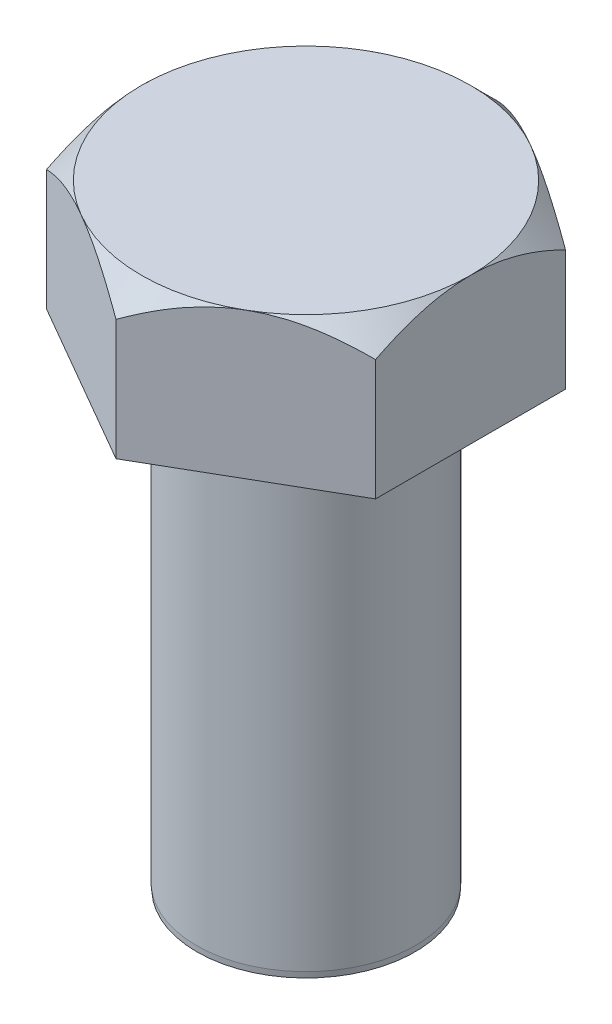
from build123d import *

# Parameters (mm, degrees)
BOSS_EXTRUDE1_DEPTH = 6.35
SKETCH2_R           = 4.7625
BOSS_EXTRUDE2_DEPTH = 20.32
SKETCH3_OUTSIDE_W   = 63.834
SKETCH3_OUTSIDE_H   = 66.046
SKETCH3_OUTSIDE_R   = 7.1501
CUT_EXTRUDE1_DEPTH  = 20.32
CUT_EXTRUDE1_DRAFT  = -45
CHAMFER1_SIZE       = 0.254
CHAMFER1_SIZE2      = 0.022222121


with BuildPart() as part:
    # Sketch1 → Boss-Extrude1 (new body)
    with BuildSketch(Plane(origin=(0, 0, 0), x_dir=(1, 0, 0), z_dir=(0, 1, 0))):
        Polygon((0, 8.256224319), (-7.1501, 4.12811216), (-7.1501, -4.12811216), (0, -8.256224319), (7.1501, -4.12811216), (7.1501, 4.12811216), align=None)
    extrude(amount=BOSS_EXTRUDE1_DEPTH)

    # Sketch2 → Boss-Extrude2 (add)
    with BuildSketch(Plane.XZ):
        with Locations(Location((0, 0, 0), (0, 0, 90))):
            Circle(SKETCH2_R)
    extrude(amount=BOSS_EXTRUDE2_DEPTH)


with BuildPart() as cut_extrude1_tool:
    # Sketch3 outside → Cut-Extrude1 (with draft: the straight prism first)
    with BuildSketch(Plane(origin=(0, 6.35, 0), x_dir=(1, 0, 0), z_dir=(0, 1, 0))):
        Rectangle(SKETCH3_OUTSIDE_W, SKETCH3_OUTSIDE_H)
        Circle(SKETCH3_OUTSIDE_R, mode=Mode.SUBTRACT)
    extrude(amount=-CUT_EXTRUDE1_DEPTH)
    # Cut-Extrude1: the draft: its side faces are tilted about the plane it starts from
    cut_extrude1_sides = [cut_extrude1_tool.faces().sort_by_distance(p)[0] for p in [
        (0, -3.81, 33.023),
        (31.917, -3.81, 0),
        (0, -3.81, -33.023),
        (-31.917, -3.81, 0),
        (-7.1501, -3.81, 0),
    ]]
    draft(cut_extrude1_sides, Plane(origin=(0, 6.35, 0), x_dir=(1, 0, 0), z_dir=(0, 1, 0)), CUT_EXTRUDE1_DRAFT)


with BuildPart() as part_1:
    add(part.part)

    # Cut-Extrude1: cut by cut_extrude1_tool
    add(cut_extrude1_tool.part, mode=Mode.SUBTRACT)

    # Chamfer1
    chamfer1_edges = [part_1.edges().sort_by_distance(p)[0] for p in [
        (0, -20.32, -4.7625),
    ]]
    chamfer1_side = [part_1.faces().sort_by_distance(p)[0] for p in [
        (0, -10.16, -4.7625),
    ]]
    chamfer(chamfer1_edges, length=CHAMFER1_SIZE, length2=CHAMFER1_SIZE2, reference=chamfer1_side[0])


solid = part_1.part
